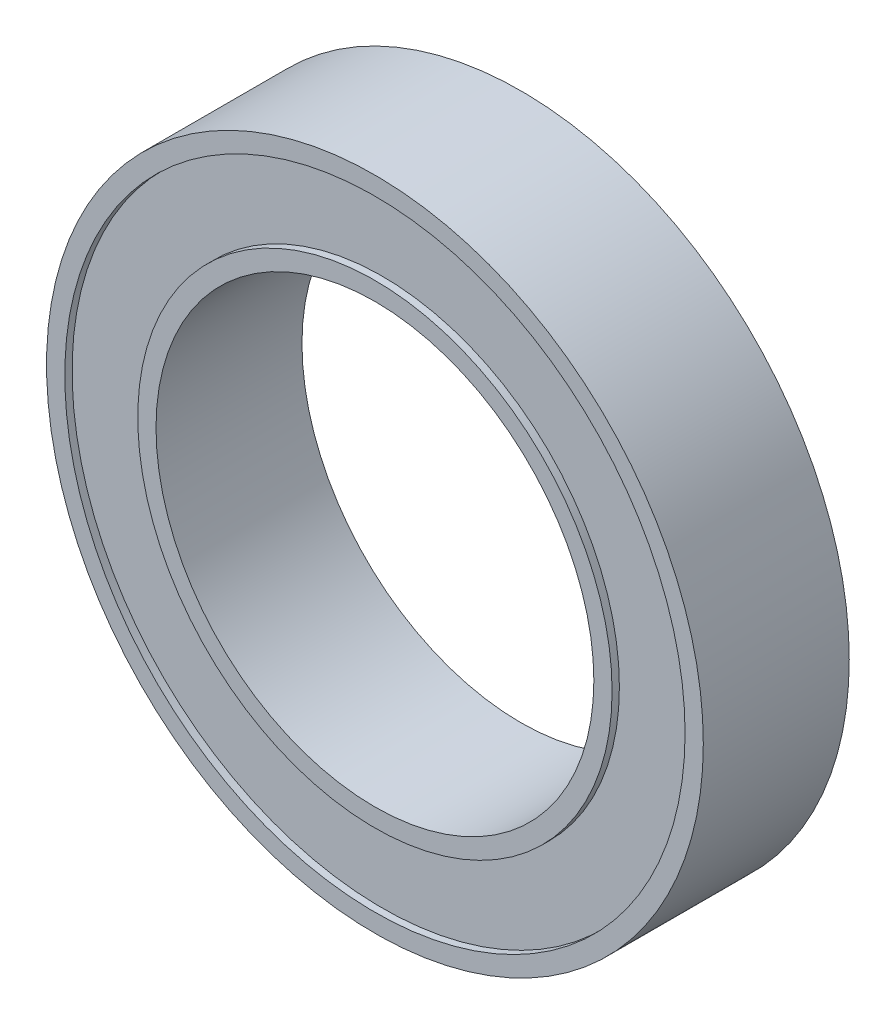
from build123d import *

# Parameters (mm, degrees)
SKETCH1_R          = 6.5
SKETCH1_R_2        = 6
EXTRUSION1_DEPTH   = 4
SKETCH1_R_3        = 9
SKETCH1_R_4        = 8.5
EXTRUSION1_2_DEPTH = 4
SKETCH2_R          = 8.5
SKETCH2_R_2        = 6.5
EXTRUSION2_DEPTH   = 3.6


with BuildPart() as part:
    # Sketch1 → Extrusion1 (new body)
    with BuildSketch(Plane.XY):
        Circle(SKETCH1_R)
        Circle(SKETCH1_R_2, mode=Mode.SUBTRACT)
    extrude(amount=EXTRUSION1_DEPTH)



with BuildPart() as body_2:
    # Sketch1 → Extrusion1 2 (new body)
    with BuildSketch(Plane.XY):
        Circle(SKETCH1_R_3)
        Circle(SKETCH1_R_4, mode=Mode.SUBTRACT)
    extrude(amount=EXTRUSION1_2_DEPTH)


with BuildPart() as part_1:
    add(part.part)

    add(body_2.part)  # Extrusion2 merges body 2
    # Sketch2 → Extrusion2 (add)
    with BuildSketch(Plane.XY.offset(0.2)):
        Circle(SKETCH2_R)
        Circle(SKETCH2_R_2, mode=Mode.SUBTRACT)
    extrude(amount=EXTRUSION2_DEPTH)


solid = part_1.part
